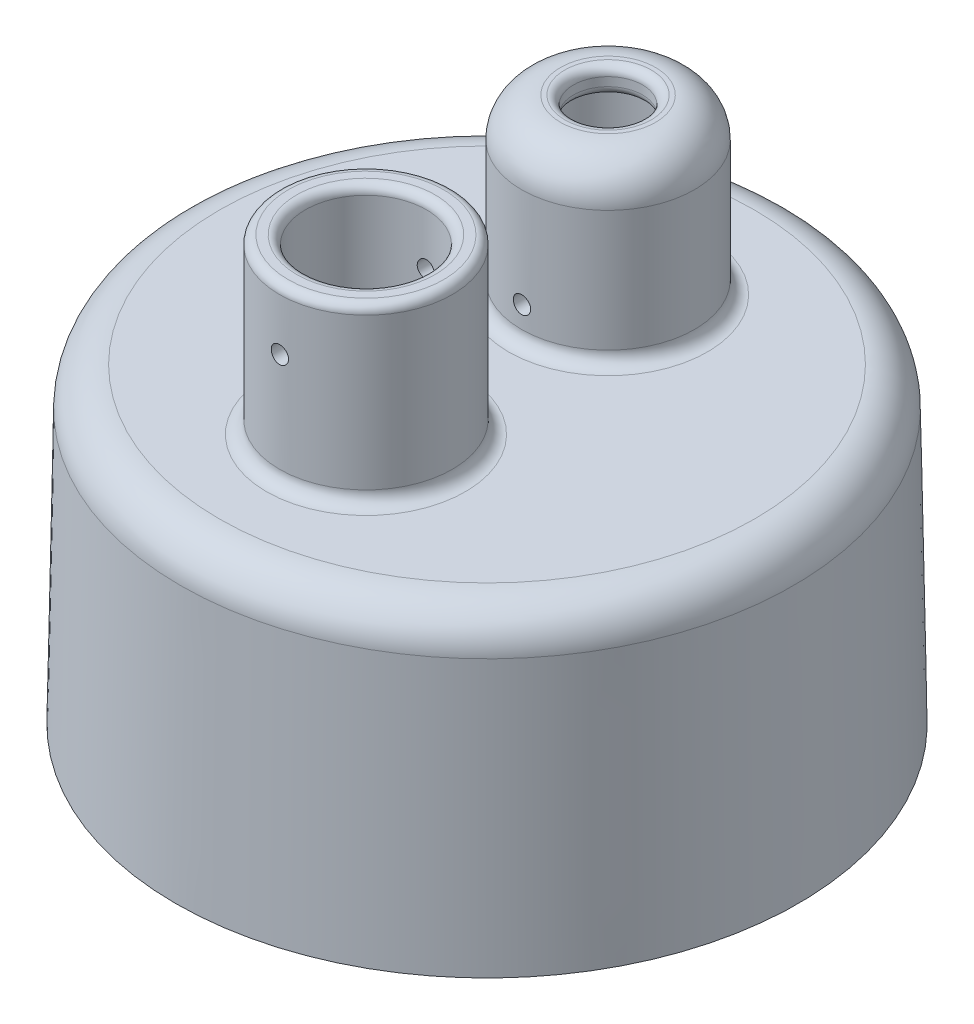
from build123d import *

# Parameters (mm, degrees)
SKETCH1_R                      = 18
BOSS_EXTRUDE1_DEPTH            = 18
SKETCH2_R                      = 16.5
CUT_EXTRUDE1_DEPTH             = 16.5
DRAFT1_ANGLE                   = -1
BOSS_EXTRUDE2_START            = 18
SKETCH3_R                      = 5
SKETCH3_R_2                    = 3.5
SKETCH3_R_3                    = 2
BOSS_EXTRUDE2_DEPTH            = 10
SKETCH4_R                      = 2
SKETCH4_R_2                    = 3.5
CUT_EXTRUDE3_DEPTH             = 8.5
CUT_EXTRUDE3_DIRECTION_2_REACH = 33.177
FILLET4_R                      = 0.5
SKETCH6_R                      = 0.5
CUT_EXTRUDE4_DEPTH             = 38.841775857
SKETCH7_R                      = 0.5
CUT_EXTRUDE5_DEPTH             = 38.841775931
FILLET5_R                      = 0.75
FILLET6_R                      = 2.25


with BuildPart() as part:
    # Sketch1 → Boss-Extrude1 (new body)
    with BuildSketch(Plane(origin=(0, 0, 0), x_dir=(1, 0, 0), z_dir=(0, 1, 0))):
        with Locations(Location((0, 0, 0), (0, 0, 270))):
            Circle(SKETCH1_R)
    extrude(amount=BOSS_EXTRUDE1_DEPTH)

    # Sketch2 → Cut-Extrude1 (cut)
    with BuildSketch(Plane(origin=(0, 0, 0), x_dir=(-1, 0, 0), z_dir=(0, -1, 0))):
        with Locations(Location((0, 0, 0), (0, 0, 90))):
            Circle(SKETCH2_R)
    extrude(amount=-CUT_EXTRUDE1_DEPTH, mode=Mode.SUBTRACT)

    # Draft1
    draft1_faces = [part.faces().sort_by_distance(p)[0] for p in [
        (0, 9, -18),
    ]]
    draft(draft1_faces, Plane(origin=(0, 0, 0), x_dir=(0, 0, -1), z_dir=(0, -1, 0)), DRAFT1_ANGLE)

    # Sketch3 → Boss-Extrude2 (add)
    # profile 1 of 2: a face of its own
    with BuildSketch(Plane(origin=(0, 0, 0), x_dir=(1, 0, 0), z_dir=(0, 1, 0)).offset(BOSS_EXTRUDE2_START)):
        with Locations(Location((0, -7, 0), (0, 0, 270))):
            Circle(SKETCH3_R)
        with Locations(Location((0, -7, 0), (0, 0, 270))):
            Circle(SKETCH3_R_2, mode=Mode.SUBTRACT)
    # profile 2 of 2: a face of its own
    with BuildSketch(Plane(origin=(0, 0, 0), x_dir=(1, 0, 0), z_dir=(0, 1, 0)).offset(BOSS_EXTRUDE2_START)):
        with Locations(Location((0, 7, 0), (0, 0, 270))):
            Circle(SKETCH3_R)
        with Locations(Location((0, 7, 0), (0, 0, 270))):
            Circle(SKETCH3_R_3, mode=Mode.SUBTRACT)
    extrude(amount=BOSS_EXTRUDE2_DEPTH)

    # Sketch4 → Cut-Extrude3 (cut)
    with BuildSketch(Plane(origin=(0, 18, 0), x_dir=(1, 0, 0), z_dir=(0, 1, 0))):
        with Locations(Location((0, -7, 0), (0, 0, 270))):
            Circle(SKETCH4_R)
        with Locations(Location((0, 7, 0), (0, 0, 90))):
            Circle(SKETCH4_R_2)
    extrude(amount=CUT_EXTRUDE3_DEPTH, mode=Mode.SUBTRACT)

    # Sketch4 → Cut-Extrude3 direction 2 (cut, up to next)
    with BuildSketch(Plane(origin=(0, 18, 0), x_dir=(1, 0, 0), z_dir=(0, 1, 0)), mode=Mode.PRIVATE) as cut_extrude3_direction_2_sk1:
        with Locations(Location((0, -7, 0), (0, 0, 270))):
            Circle(SKETCH4_R)
    cut_extrude3_direction_2_tool1 = extrude(cut_extrude3_direction_2_sk1.sketch, amount=-CUT_EXTRUDE3_DIRECTION_2_REACH, mode=Mode.PRIVATE) & part.part
    # Sketch4 → Cut-Extrude3 direction 2 (cut, up to next)
    with BuildSketch(Plane(origin=(0, 18, 0), x_dir=(1, 0, 0), z_dir=(0, 1, 0)), mode=Mode.PRIVATE) as cut_extrude3_direction_2_sk2:
        with Locations(Location((0, 7, 0), (0, 0, 90))):
            Circle(SKETCH4_R_2)
    cut_extrude3_direction_2_tool2 = extrude(cut_extrude3_direction_2_sk2.sketch, amount=-CUT_EXTRUDE3_DIRECTION_2_REACH, mode=Mode.PRIVATE) & part.part
    add(cut_extrude3_direction_2_tool1.solids().sort_by_distance((0, 18, 7))[0], mode=Mode.SUBTRACT)
    add(cut_extrude3_direction_2_tool2.solids().sort_by_distance((0, 18, -7))[0], mode=Mode.SUBTRACT)

    # Fillet4
    fillet4_edges = [part.edges().sort_by_distance(p)[0] for p in [
        (0, 28, 2),
        (0, 28, 3.5),
        (0, 28, -9),
        (0, 18, 5),
        (0, 16.5, 5),
        (0, 26.5, -9),
    ]]
    fillet(fillet4_edges, radius=FILLET4_R)

    # Sketch6 → Cut-Extrude4 (cut, through all)
    with BuildSketch(Plane.XY):
        with Locations((0, 20)):
            Circle(SKETCH6_R)
    extrude(amount=-CUT_EXTRUDE4_DEPTH, mode=Mode.SUBTRACT)

    # Sketch7 → Cut-Extrude5 (cut, through all)
    with BuildSketch(Plane.XY):
        with Locations(Location((0, 24.5, 0), (0, 0, 180))):
            Circle(SKETCH7_R)
    extrude(amount=CUT_EXTRUDE5_DEPTH, mode=Mode.SUBTRACT)

    # Fillet5
    fillet5_edges = [part.edges().sort_by_distance(p)[0] for p in [
        (0, 18, 3.5),
        (0, 18, 2),
        (0, 18, -12),
        (0, 26.5, -3.5),
        (0, 16.5, 16.5),
    ]]
    fillet(fillet5_edges, radius=FILLET5_R)

    # Fillet6
    fillet6_edges = [part.edges().sort_by_distance(p)[0] for p in [
        (0, 28, -12),
        (0, 16.5, -3.5),
        (0, 18, -17.685808831),
    ]]
    fillet(fillet6_edges, radius=FILLET6_R)


solid = part.part
